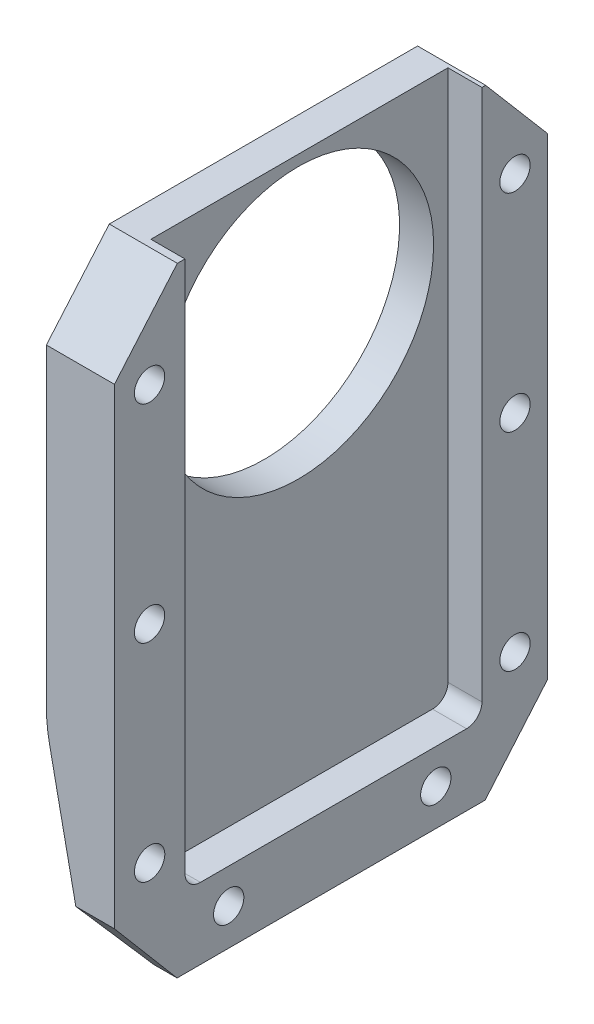
from build123d import *

# Parameters (mm, degrees)
BOSS_EXTRUDE1_DEPTH                   = 35.56
FILLET1_R                             = 12.7
SKETCH6_W                             = 24.384
SKETCH6_H                             = 44.958
CUT_EXTRUDE1_DEPTH                    = 2.794
FILLET2_R                             = 1.27
CUT_EXTRUDE3_DEPTH                    = 63.260576162
CUT_EXTRUDE4_DEPTH                    = 63.260576162
F_7_8_0_875_DIAMETER_HOLE1_D          = 22.225
F_40_0_098_DIAMETER_HOLE1_D           = 2.4892
F_40_0_098_DIAMETER_HOLE1_CSINK_D     = 3.7592
F_40_0_098_DIAMETER_HOLE1_CSINK_ANGLE = 90


with BuildPart() as part:
    # Sketch1 → Boss-Extrude1 (new body)
    with BuildSketch(Plane.XY):
        Polygon((0, 0), (0, 50.8), (-5.588, 50.8), (-5.588, 17.78), (-1.916643762, 0), align=None)
    extrude(amount=BOSS_EXTRUDE1_DEPTH)

    # Fillet1
    fillet1_edges = [part.edges().sort_by_distance(p)[0] for p in [
        (-5.588, 17.78, 17.78),
    ]]
    fillet(fillet1_edges, radius=FILLET1_R)

    # Sketch6 → Cut-Extrude1 (cut)
    with BuildSketch(Plane(origin=(0, 0, 0), x_dir=(0, 0, -1), z_dir=(1, 0, 0))):
        with Locations((-17.580042727, 28.321)):
            Rectangle(SKETCH6_W, SKETCH6_H)
    extrude(amount=-CUT_EXTRUDE1_DEPTH, mode=Mode.SUBTRACT)

    # Fillet2
    fillet2_edges = [part.edges().sort_by_distance(p)[0] for p in [
        (-1.397, 5.842, 29.772042727),
        (-1.397, 5.842, 5.388042727),
    ]]
    fillet(fillet2_edges, radius=FILLET2_R)

    # Sketch10 → Cut-Extrude3 (cut, through all)
    with BuildSketch(Plane(origin=(0, 0, 0), x_dir=(0, 0, -1), z_dir=(1, 0, 0))):
        Polygon((-35.56, 44.780420684), (-30.397580851, 50.8), (-35.56, 50.8), align=None)
    extrude(amount=-CUT_EXTRUDE3_DEPTH, mode=Mode.SUBTRACT)

    # Sketch11 → Cut-Extrude4 (cut, through all)
    with BuildSketch(Plane(origin=(0, 0, 0), x_dir=(0, 0, -1), z_dir=(1, 0, 0))):
        Polygon((-5.085545117, 50.8), (0, 50.8), (0, 44.824895363), align=None)
        Polygon((0, 6.029531172), (-5.128692816, 0), (0, 0), align=None)
        Polygon((-35.56, 6.07121688), (-35.56, 0), (-30.417091858, 0), align=None)
    extrude(amount=-CUT_EXTRUDE4_DEPTH, mode=Mode.SUBTRACT)

    # 7/8 (0.875) Diameter Hole1 (through all)
    with Locations(Plane.ZY.offset(5.588)):
        with Locations((17.678535919, 38.809523369)):
            Hole(F_7_8_0_875_DIAMETER_HOLE1_D / 2)

    # #40 (0.098) Diameter Hole1 (through all)
    with Locations(Plane.ZY.offset(5.588)):
        with Locations((2.678535919, 43.309523369), (2.678535919, 26.309523369), (2.678535919, 9.309523369), (9.178535919, 3.009523369), (26.181895158, 2.999179942), (32.672944692, 9.309523369), (32.678535919, 26.309523369), (32.678535919, 43.309523369)):
            CounterSinkHole(F_40_0_098_DIAMETER_HOLE1_D / 2, F_40_0_098_DIAMETER_HOLE1_CSINK_D / 2, counter_sink_angle=F_40_0_098_DIAMETER_HOLE1_CSINK_ANGLE)


solid = part.part
